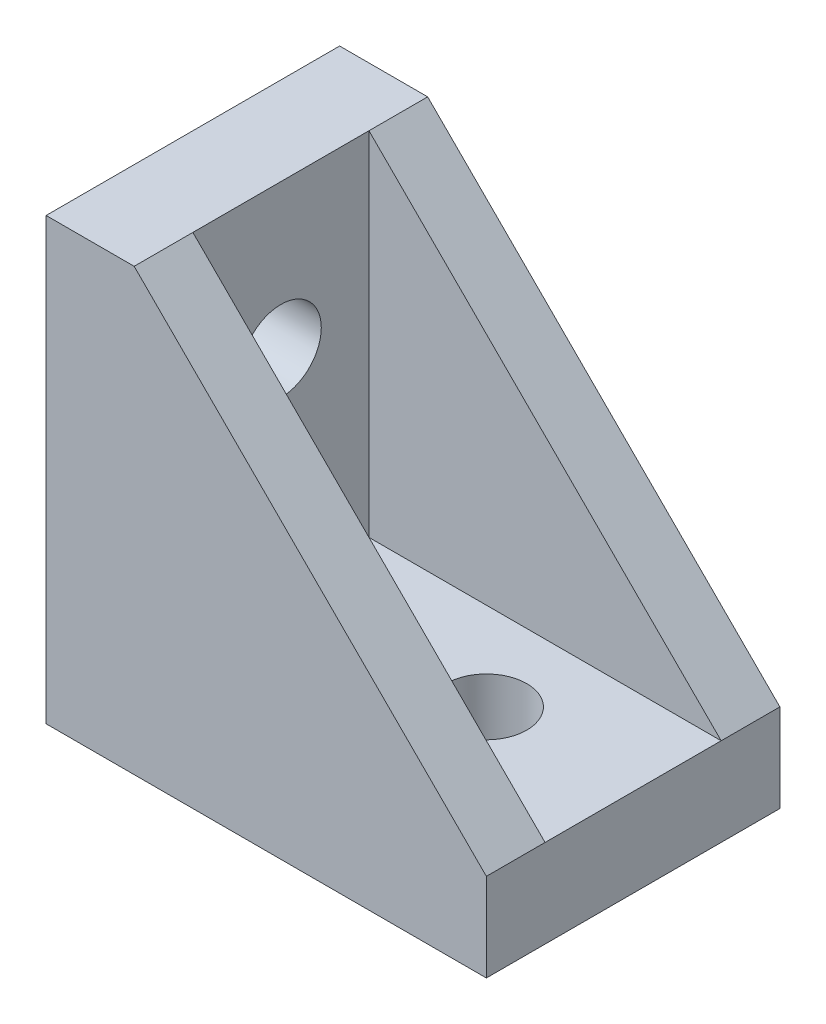
from build123d import *

# Parameters (mm, degrees)
BOSS_EXTRUDE1_DEPTH  = 10
M5_CLEARANCE_HOLE1_D = 5.5
GUSSET1_THICKNESS    = 4


with BuildPart() as part:
    # Sketch1 → Boss-Extrude1 (new, symmetric)
    with BuildSketch(Plane.XY):
        Polygon((0, 0), (0, 30), (6, 30), (6, 6), align=None)
    extrude(amount=BOSS_EXTRUDE1_DEPTH, both=True)

    # M5 Clearance Hole1 (through all)
    with Locations(Plane(origin=(6, 0, 0), x_dir=(0, 0, -1), z_dir=(1, 0, 0))):
        with Locations((0, 20)):
            Hole(M5_CLEARANCE_HOLE1_D / 2)

    # Mirror1: part across plane


with BuildPart() as part_1:
    add(part.part)
    add(part.part.mirror(Plane(origin=(0, 0, 10), x_dir=(0, 0, 1), z_dir=(0.7071067811865476, -0.7071067811865476, 0))))


with BuildPart() as body_2:
    # Gusset1: a gusset: a plate 4.0 thick in the corner of two members, its outline drawn in place
    gusset1_outline = Wire([Line((6, 6, -10), (6, 30, -10)), Line((6, 30, -10), (30, 6, -10)), Line((30, 6, -10), (6, 6, -10))])
    add(extrude(Face(gusset1_outline), amount=GUSSET1_THICKNESS, dir=(0, 0, 1)))


with BuildPart() as body_3:
    # Mirror3: mirrored copy
    add(body_2.part.mirror(Plane.XY))


with BuildPart() as part_2:
    add(part_1.part)

    # Combine1: union body 3, body 2
    add(body_3.part)
    add(body_2.part)


solid = part_2.part
